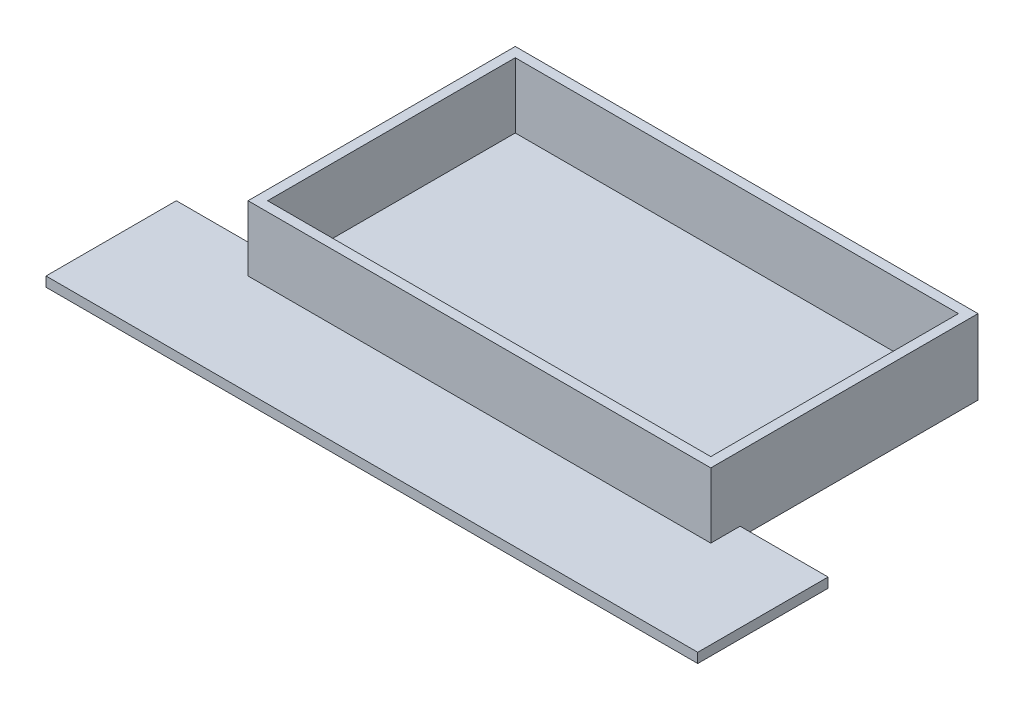
from build123d import *

# Parameters (mm, degrees)
SKETCH_1_W      = 71
SKETCH_1_H      = 41
EXTRUDE_1_DEPTH = 1.5
SKETCH_2_W      = 71
SKETCH_2_H      = 41
SKETCH_2_W_2    = 68
SKETCH_2_H_2    = 38
EXTRUDE_2_DEPTH = 10
SKETCH_3_W      = 100
SKETCH_3_H      = 20
EXTRUDE_3_DEPTH = 1.5


with BuildPart() as part:
    # 草图1 → 凸台-拉伸1 (new body)
    with BuildSketch(Plane(origin=(0, 0, 0), x_dir=(1, 0, 0), z_dir=(0, 1, 0))):
        with Locations((35.5, -20.5)):
            Rectangle(SKETCH_1_W, SKETCH_1_H)
    extrude(amount=EXTRUDE_1_DEPTH)

    # 草图2 → 凸台-拉伸2 (add)
    with BuildSketch(Plane(origin=(0, 1.5, 0), x_dir=(1, 0, 0), z_dir=(0, 1, 0))):
        with Locations((35.5, -20.5)):
            Rectangle(SKETCH_2_W, SKETCH_2_H)
        with Locations((35.5, -20.5)):
            Rectangle(SKETCH_2_W_2, SKETCH_2_H_2, mode=Mode.SUBTRACT)
    extrude(amount=EXTRUDE_2_DEPTH)

    # 草图3 → 凸台-拉伸3 (add)
    with BuildSketch(Plane(origin=(0, 0, 0), x_dir=(-1, 0, 0), z_dir=(0, -1, 0))):
        with Locations((-34.5, -46.5)):
            Rectangle(SKETCH_3_W, SKETCH_3_H)
    extrude(amount=-EXTRUDE_3_DEPTH)


solid = part.part
